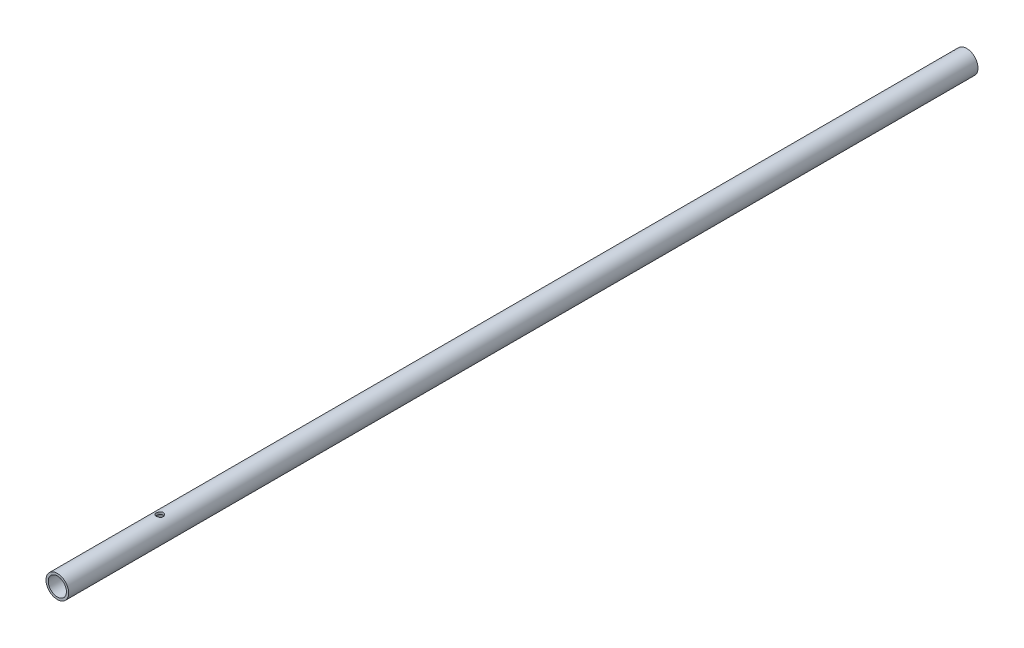
from build123d import *

# Parameters (mm, degrees)
SKETCH_1_R          = 5
SKETCH_1_R_2        = 4
EXTRUDE_1_DEPTH     = 400
SKETCH_2_R          = 1.5
CUT_EXTRUDE_1_DEPTH = 401.062495118
SKETCH_3_R          = 1.5
CUT_EXTRUDE_2_DEPTH = 401.06249522


with BuildPart() as part:
    # 草图1 → 凸台-拉伸1 (new body)
    with BuildSketch(Plane.XY):
        Circle(SKETCH_1_R)
        Circle(SKETCH_1_R_2, mode=Mode.SUBTRACT)
    extrude(amount=EXTRUDE_1_DEPTH)

    # 草图2 → 切除-拉伸1 (cut, through all)
    with BuildSketch(Plane(origin=(0, 0, 0), x_dir=(1, 0, 0), z_dir=(0, 1, 0))):
        with Locations(Location((0, -31.334408431, 0), (0, 0, 270))):
            Circle(SKETCH_2_R)
    extrude(amount=-CUT_EXTRUDE_1_DEPTH, mode=Mode.SUBTRACT)

    # 草图3 → 切除-拉伸2 (cut, through all)
    with BuildSketch(Plane(origin=(0, 0, 0), x_dir=(1, 0, 0), z_dir=(0, 1, 0))):
        with Locations(Location((0, -355, 0), (0, 0, 90))):
            Circle(SKETCH_3_R)
    extrude(amount=CUT_EXTRUDE_2_DEPTH, mode=Mode.SUBTRACT)


solid = part.part
